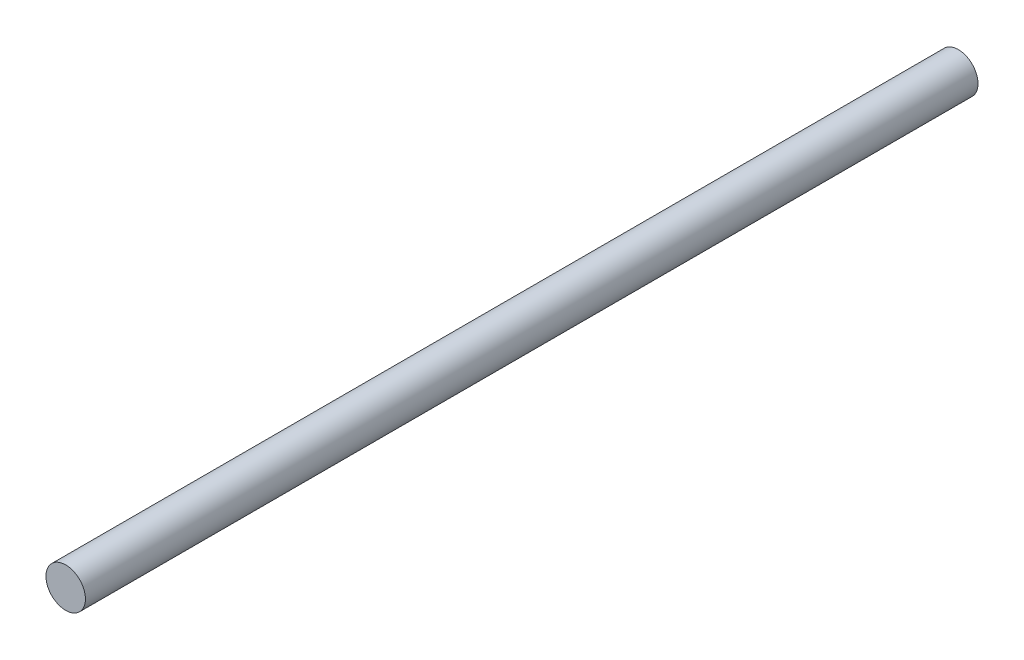
from build123d import *

# Parameters (mm, degrees)
SKETCH1_R           = 4.8625
BOSS_EXTRUDE1_DEPTH = 110


with BuildPart() as part:
    # Sketch1 → Boss-Extrude1 (new, symmetric)
    with BuildSketch(Plane.XY):
        Circle(SKETCH1_R)
    extrude(amount=BOSS_EXTRUDE1_DEPTH, both=True)


solid = part.part
